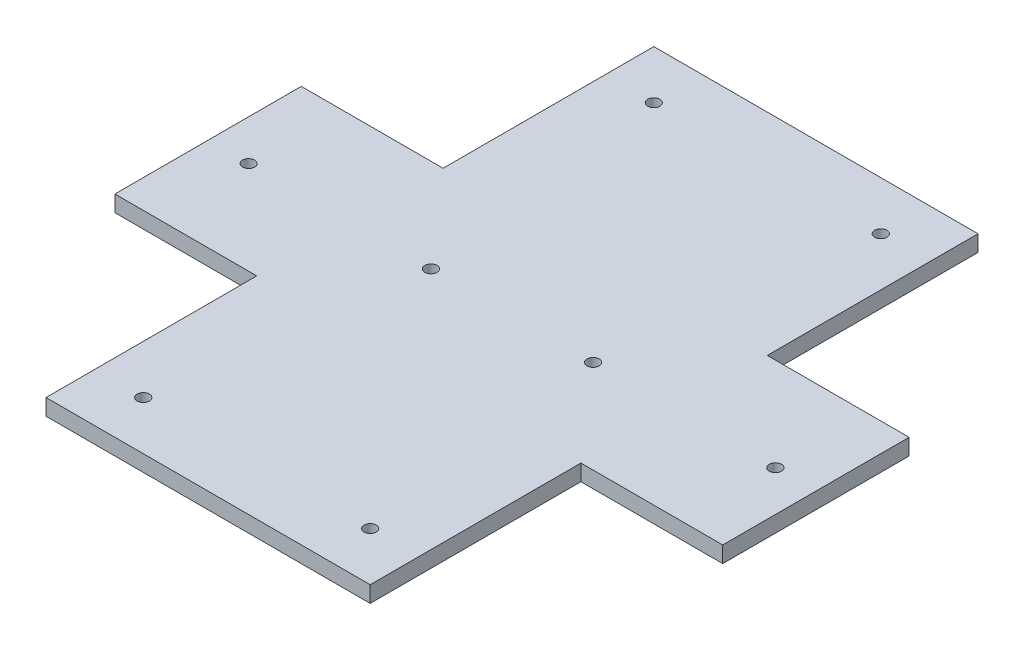
from build123d import *

# Parameters (mm, degrees)
SKETCH1_R           = 1.5
BOSS_EXTRUDE1_DEPTH = 4


with BuildPart() as part:
    # Sketch1 → Boss-Extrude1 (new body)
    with BuildSketch(Plane(origin=(0, 0, 0), x_dir=(1, 0, 0), z_dir=(0, 1, 0))):
        Polygon((-75, -23), (-40, -23), (-40, -75), (40, -75), (40, -23), (75, -23), (75, 23), (40, 23), (40, 75), (-40, 75), (-40, 23), (-75, 23), align=None)
        with Locations(Location((20, 0, 0), (0, 0, 270))):
            Circle(SKETCH1_R, mode=Mode.SUBTRACT)
        with Locations(Location((65, 0, 0), (0, 0, 270))):
            Circle(SKETCH1_R, mode=Mode.SUBTRACT)
        with Locations(Location((-65, 0, 0), (0, 0, 90))):
            Circle(SKETCH1_R, mode=Mode.SUBTRACT)
        with Locations(Location((-20, 0, 0), (0, 0, 90))):
            Circle(SKETCH1_R, mode=Mode.SUBTRACT)
        with Locations(Location((-28, 63, 0), (0, 0, 270))):
            Circle(SKETCH1_R, mode=Mode.SUBTRACT)
        with Locations(Location((28, 63, 0), (0, 0, 270))):
            Circle(SKETCH1_R, mode=Mode.SUBTRACT)
        with Locations(Location((28, -63, 0), (0, 0, 270))):
            Circle(SKETCH1_R, mode=Mode.SUBTRACT)
        with Locations(Location((-28, -63, 0), (0, 0, 270))):
            Circle(SKETCH1_R, mode=Mode.SUBTRACT)
    extrude(amount=BOSS_EXTRUDE1_DEPTH)


solid = part.part
